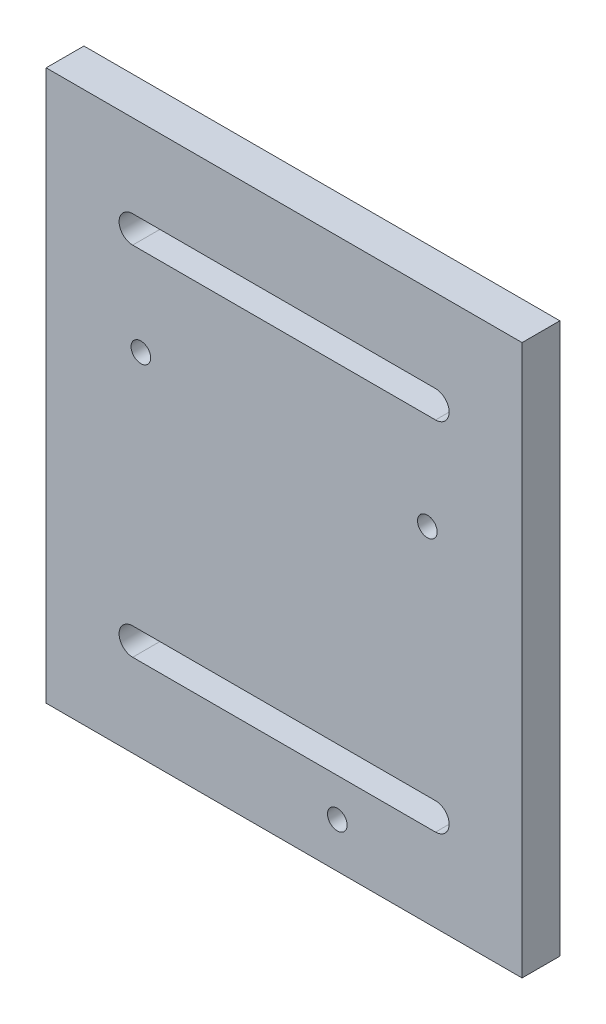
from build123d import *

# Parameters (mm, degrees)
SKETCH1_W           = 80
SKETCH1_H           = 92.5
SKETCH1_R           = 1.65
BOSS_EXTRUDE2_DEPTH = 6.35


with BuildPart() as part:
    # Sketch1 → Boss-Extrude2 (new body)
    with BuildSketch(Plane.XY):
        Rectangle(SKETCH1_W, SKETCH1_H)
        with Locations((-24.08, 12.8)):
            Circle(SKETCH1_R, mode=Mode.SUBTRACT)
        with Locations((24.08, 11.53)):
            Circle(SKETCH1_R, mode=Mode.SUBTRACT)
        with Locations((8.94, -38.71)):
            Circle(SKETCH1_R, mode=Mode.SUBTRACT)
        with BuildLine():
            Line((-25.454545455, 32.285), (25.454545455, 32.285))
            ThreePointArc((25.454545455, 32.285), (27.739545455, 30), (25.454545455, 27.715))
            Line((25.454545455, 27.715), (-25.454545455, 27.715))
            ThreePointArc((-25.454545455, 27.715), (-27.739545455, 30), (-25.454545455, 32.285))
        make_face(mode=Mode.SUBTRACT)
        with BuildLine():
            Line((-25.454545455, -27.715), (25.454545455, -27.715))
            ThreePointArc((25.454545455, -27.715), (27.739545455, -30), (25.454545455, -32.285))
            Line((25.454545455, -32.285), (-25.454545455, -32.285))
            ThreePointArc((-25.454545455, -32.285), (-27.739545455, -30), (-25.454545455, -27.715))
        make_face(mode=Mode.SUBTRACT)
    extrude(amount=BOSS_EXTRUDE2_DEPTH)


solid = part.part
